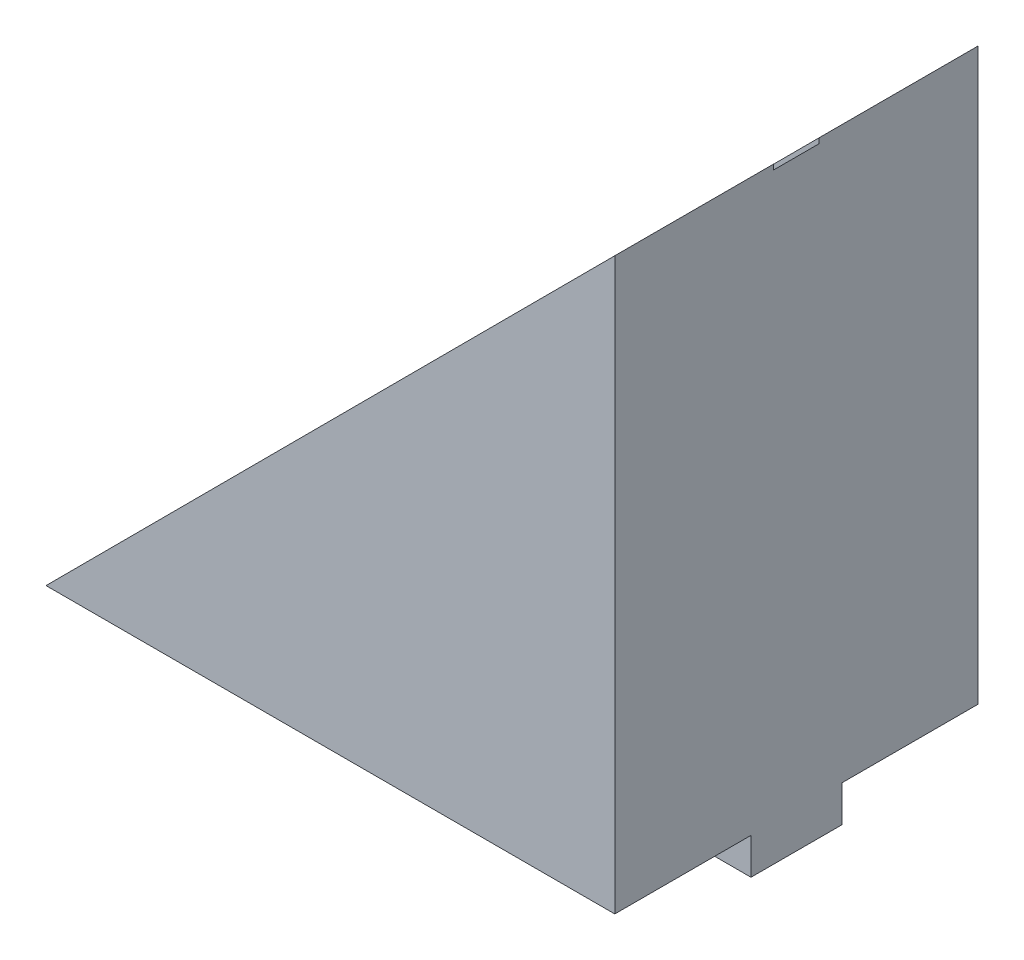
from build123d import *

# Parameters (mm, degrees)
BOSS_EXTRUDE1_DEPTH = 25.4
SKETCH3_W           = 39.775281732
SKETCH3_H           = 6.35
BOSS_EXTRUDE2_DEPTH = 2.54
SKETCH4_W           = 3.175
SKETCH4_H           = 56.314123931
CUT_EXTRUDE1_DEPTH  = 0.254


with BuildPart() as part:
    # Sketch1 → Boss-Extrude1 (new body)
    with BuildSketch(Plane.XY):
        Polygon((0, 0), (16.712640866, 0), (23.062640866, 0), (39.775281732, 0), (39.775281732, 39.8648657), align=None)
    extrude(amount=BOSS_EXTRUDE1_DEPTH)

    # Sketch3 → Boss-Extrude2 (add)
    with BuildSketch(Plane.XZ):
        with Locations((19.887640866, 12.7)):
            Rectangle(SKETCH3_W, SKETCH3_H)
    extrude(amount=BOSS_EXTRUDE2_DEPTH)

    # Sketch4 → Cut-Extrude1 (cut)
    with BuildSketch(Plane(origin=(0, 0, 0), x_dir=(0, 0, 1), z_dir=(-0.7079017290339694, 0.706310938631646, 0))):
        with Locations((12.7, 28.157061966)):
            Rectangle(SKETCH4_W, SKETCH4_H)
    extrude(amount=-CUT_EXTRUDE1_DEPTH, mode=Mode.SUBTRACT)


solid = part.part
